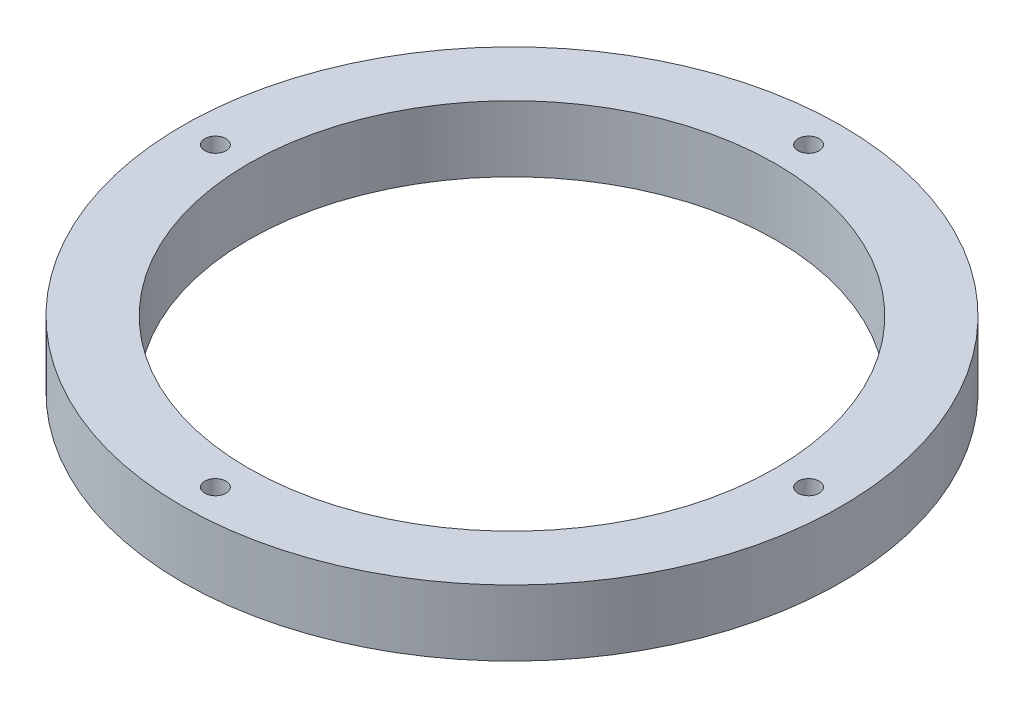
from build123d import *

# Parameters (mm, degrees)
SKETCH_1_R      = 50
SKETCH_1_R_2    = 40
SKETCH_1_R_3    = 1.6
EXTRUDE_1_DEPTH = 10


with BuildPart() as part:
    # 草图1 → 凸台-拉伸1 (new body)
    with BuildSketch(Plane(origin=(0, 0, 0), x_dir=(1, 0, 0), z_dir=(0, 1, 0))):
        with Locations(Location((0, 0, 0), (0, 0, 270))):
            Circle(SKETCH_1_R)
        with Locations(Location((0, 0, 0), (0, 0, 270))):
            Circle(SKETCH_1_R_2, mode=Mode.SUBTRACT)
        with Locations(Location((0, 45, 0), (0, 0, 270))):
            Circle(SKETCH_1_R_3, mode=Mode.SUBTRACT)
        with Locations(Location((45, 0, 0), (0, 0, 270))):
            Circle(SKETCH_1_R_3, mode=Mode.SUBTRACT)
        with Locations(Location((0, -45, 0), (0, 0, 270))):
            Circle(SKETCH_1_R_3, mode=Mode.SUBTRACT)
        with Locations(Location((-45, 0, 0), (0, 0, 270))):
            Circle(SKETCH_1_R_3, mode=Mode.SUBTRACT)
    extrude(amount=EXTRUDE_1_DEPTH)


solid = part.part
